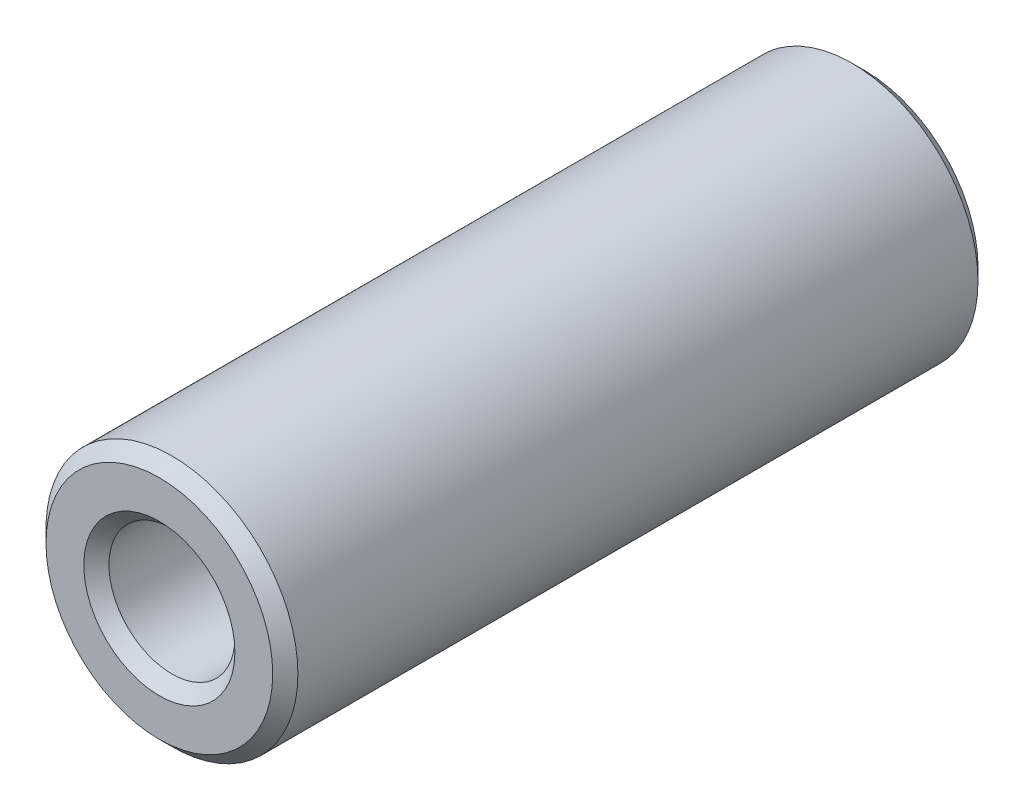
from build123d import *

# Parameters (mm, degrees)
SKETCH1_R           = 5
SKETCH1_R_2         = 2.5
BOSS_EXTRUDE1_DEPTH = 14
CHAMFER1_SIZE       = 0.5


with BuildPart() as part:
    # Sketch1 → Boss-Extrude1 (new, symmetric)
    with BuildSketch(Plane(origin=(0, 0, 0), x_dir=(0, 1, 0), z_dir=(0, 0, 1))):
        with Locations(Location((0, 0, 0), (0, 0, 270))):
            Circle(SKETCH1_R)
        with Locations(Location((0, 0, 0), (0, 0, 270))):
            Circle(SKETCH1_R_2, mode=Mode.SUBTRACT)
    extrude(amount=BOSS_EXTRUDE1_DEPTH, both=True)

    # Chamfer1
    chamfer1_edges = [part.edges().sort_by_distance(p)[0] for p in [
        (-5, 0, -14),
        (-5, 0, 14),
        (-2.5, 0, -14),
        (-2.5, 0, 14),
    ]]
    chamfer(chamfer1_edges, length=CHAMFER1_SIZE)


solid = part.part
